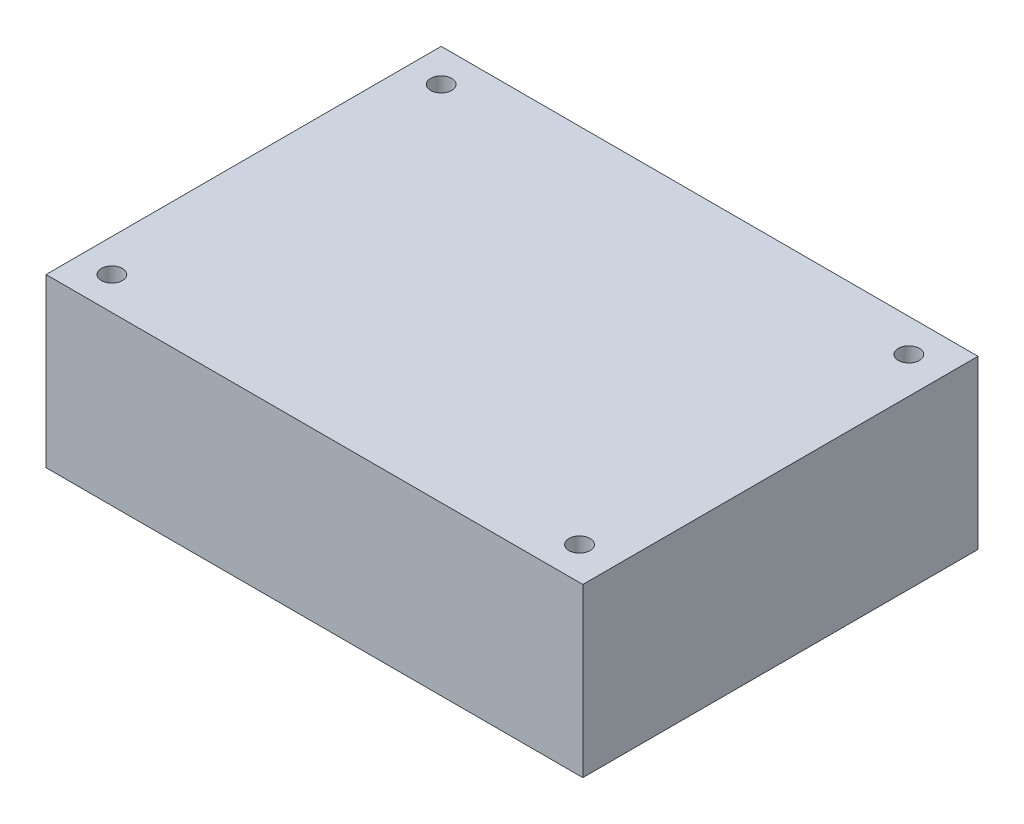
from build123d import *

# Parameters (mm, degrees)
SKETCH1_W             = 81.4999894
SKETCH1_H             = 59.99988
BOSS_EXTRUDE1_DEPTH   = 25.4
F_3_2MM_MOUNT_HOLES_D = 3.2


with BuildPart() as part:
    # Sketch1 → Boss-Extrude1 (new body)
    with BuildSketch(Plane(origin=(0, 0, 0), x_dir=(1, 0, 0), z_dir=(0, 1, 0))):
        Rectangle(SKETCH1_W, SKETCH1_H)
    extrude(amount=BOSS_EXTRUDE1_DEPTH)

    # 3.2mm Mount holes (through all)
    with Locations(Plane(origin=(0, 25.4, 0), x_dir=(1, 0, 0), z_dir=(0, 1, 0))):
        with Locations((-35.7500047, 24.99995), (35.2501073, -24.99995), (35.2501073, 24.99995), (-35.7500047, -24.99995)):
            Hole(F_3_2MM_MOUNT_HOLES_D / 2)


solid = part.part
